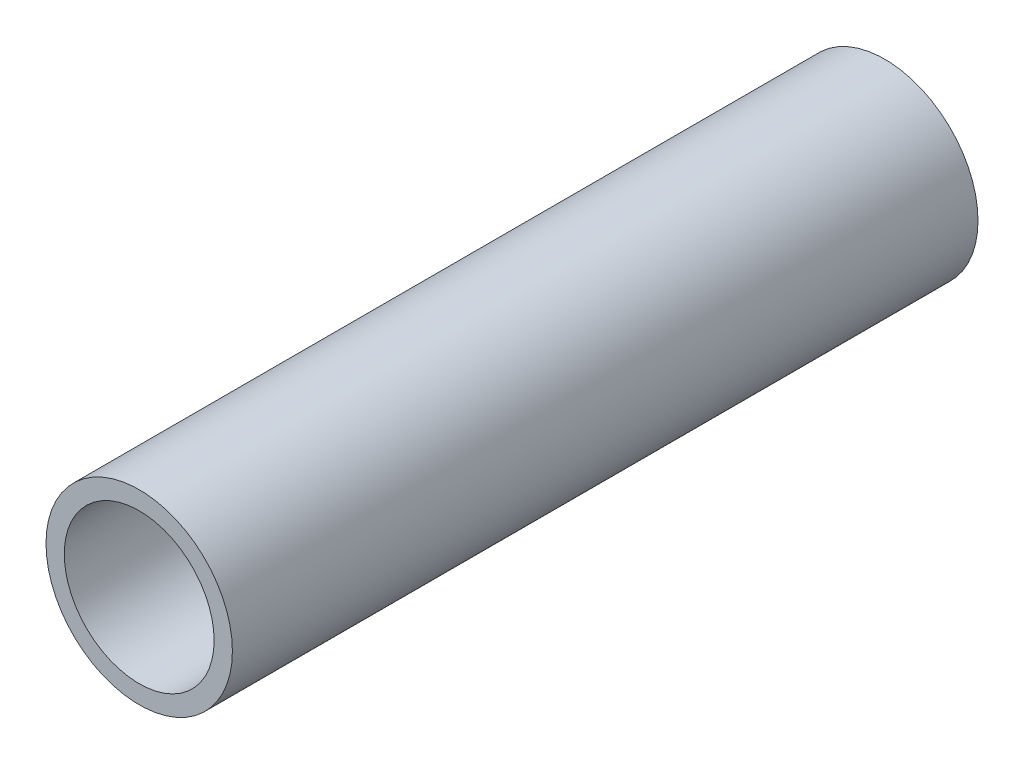
from build123d import *

# Parameters (mm, degrees)
SKETCH2_R           = 6.35
SKETCH2_R_2         = 5.1054
BOSS_EXTRUDE1_DEPTH = 50.8


with BuildPart() as part:
    # Sketch2 → Boss-Extrude1 (new body)
    with BuildSketch(Plane.XY):
        Circle(SKETCH2_R)
        Circle(SKETCH2_R_2, mode=Mode.SUBTRACT)
    extrude(amount=BOSS_EXTRUDE1_DEPTH)


solid = part.part
